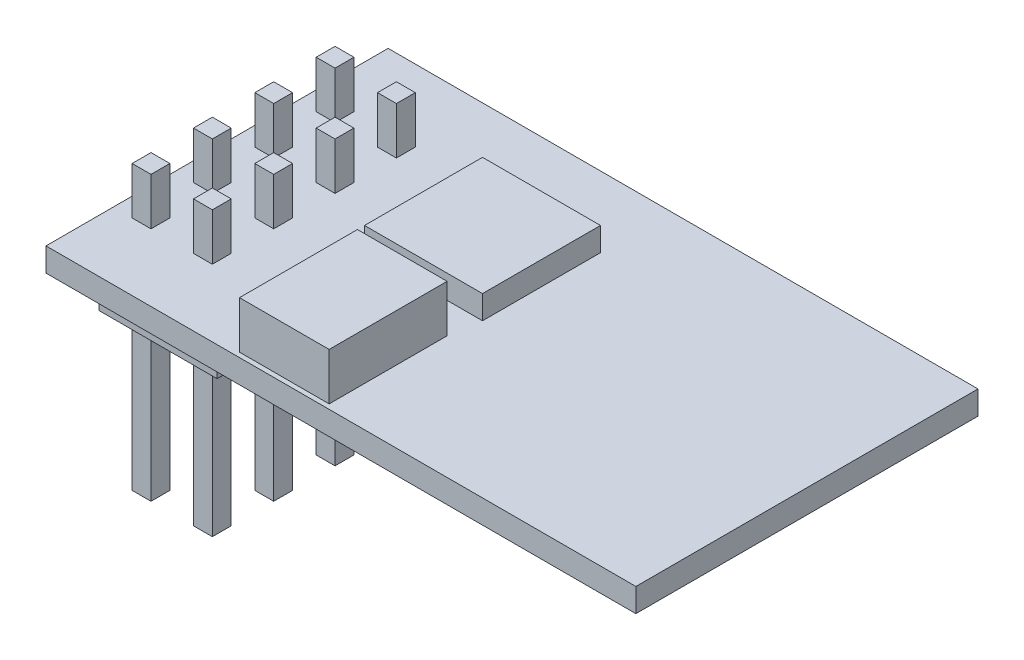
from build123d import *

# Parameters (mm, degrees)
ESQUISSE1_W        = 25
ESQUISSE1_H        = 14.5
BOSS_EXTRU_1_DEPTH = 1
ESQUISSE2_W        = 3.8
ESQUISSE2_H        = 5
BOSS_EXTRU_2_DEPTH = 2
ESQUISSE2_3_W      = 5
ESQUISSE2_3_H      = 5
BOSS_EXTRU_3_DEPTH = 1
BOSS_EXTRU_4_START = -1
ESQUISSE2_4_W      = 5
ESQUISSE2_4_H      = 10
BOSS_EXTRU_4_DEPTH = 2.5
BOSS_EXTRU_5_START = -3.5
ESQUISSE2_5_W      = 0.8
ESQUISSE2_5_H      = 0.8
BOSS_EXTRU_5_DEPTH = 6.5
ESQUISSE2_6_W      = 0.8
ESQUISSE2_6_H      = 0.8
BOSS_EXTRU_6_DEPTH = 2


with BuildPart() as part:
    # Esquisse1 → Boss.-Extru.1 (new body)
    with BuildSketch(Plane(origin=(0, 0, 0), x_dir=(1, 0, 0), z_dir=(0, 1, 0))):
        with Locations((-12.5, -7.25)):
            Rectangle(ESQUISSE1_W, ESQUISSE1_H)
    extrude(amount=BOSS_EXTRU_1_DEPTH)

    # Esquisse2 → Boss.-Extru.2 (add)
    with BuildSketch(Plane(origin=(0, 1, 0), x_dir=(1, 0, 0), z_dir=(0, 1, 0))):
        with Locations((-15.1, -11.8)):
            Rectangle(ESQUISSE2_W, ESQUISSE2_H)
    extrude(amount=BOSS_EXTRU_2_DEPTH)

    # Esquisse2<3> → Boss.-Extru.3 (add)
    with BuildSketch(Plane(origin=(0, 1, 0), x_dir=(1, 0, 0), z_dir=(0, 1, 0))):
        with Locations((-15.5, -5.5)):
            Rectangle(ESQUISSE2_3_W, ESQUISSE2_3_H)
    extrude(amount=BOSS_EXTRU_3_DEPTH)

    # Esquisse2<4> → Boss.-Extru.4 (add)
    with BuildSketch(Plane(origin=(0, 1, 0), x_dir=(1, 0, 0), z_dir=(0, 1, 0)).offset(BOSS_EXTRU_4_START)):
        with Locations((-22.5, -7.25)):
            Rectangle(ESQUISSE2_4_W, ESQUISSE2_4_H)
    extrude(amount=-BOSS_EXTRU_4_DEPTH)

    # Esquisse2<5> → Boss.-Extru.5 (add)
    with BuildSketch(Plane(origin=(0, 1, 0), x_dir=(1, 0, 0), z_dir=(0, 1, 0)).offset(BOSS_EXTRU_5_START)):
        with Locations((-23.8, -3.45)):
            Rectangle(ESQUISSE2_5_W, ESQUISSE2_5_H)
        with Locations((-21.2, -3.45)):
            Rectangle(ESQUISSE2_5_W, ESQUISSE2_5_H)
        with Locations((-21.2, -6.05)):
            Rectangle(ESQUISSE2_5_W, ESQUISSE2_5_H)
        with Locations((-21.2, -8.65)):
            Rectangle(ESQUISSE2_5_W, ESQUISSE2_5_H)
        with Locations((-21.2, -11.25)):
            Rectangle(ESQUISSE2_5_W, ESQUISSE2_5_H)
        with Locations((-23.8, -11.25)):
            Rectangle(ESQUISSE2_5_W, ESQUISSE2_5_H)
        with Locations((-23.8, -6.05)):
            Rectangle(ESQUISSE2_5_W, ESQUISSE2_5_H)
        with Locations((-23.8, -8.65)):
            Rectangle(ESQUISSE2_5_W, ESQUISSE2_5_H)
    extrude(amount=-BOSS_EXTRU_5_DEPTH)

    # Esquisse2<6> → Boss.-Extru.6 (add)
    with BuildSketch(Plane(origin=(0, 1, 0), x_dir=(1, 0, 0), z_dir=(0, 1, 0))):
        with Locations((-23.8, -3.45)):
            Rectangle(ESQUISSE2_6_W, ESQUISSE2_6_H)
        with Locations((-21.2, -3.45)):
            Rectangle(ESQUISSE2_6_W, ESQUISSE2_6_H)
        with Locations((-21.2, -6.05)):
            Rectangle(ESQUISSE2_6_W, ESQUISSE2_6_H)
        with Locations((-23.8, -6.05)):
            Rectangle(ESQUISSE2_6_W, ESQUISSE2_6_H)
        with Locations((-23.8, -8.65)):
            Rectangle(ESQUISSE2_6_W, ESQUISSE2_6_H)
        with Locations((-21.2, -8.65)):
            Rectangle(ESQUISSE2_6_W, ESQUISSE2_6_H)
        with Locations((-21.2, -11.25)):
            Rectangle(ESQUISSE2_6_W, ESQUISSE2_6_H)
        with Locations((-23.8, -11.25)):
            Rectangle(ESQUISSE2_6_W, ESQUISSE2_6_H)
    extrude(amount=BOSS_EXTRU_6_DEPTH)


solid = part.part
